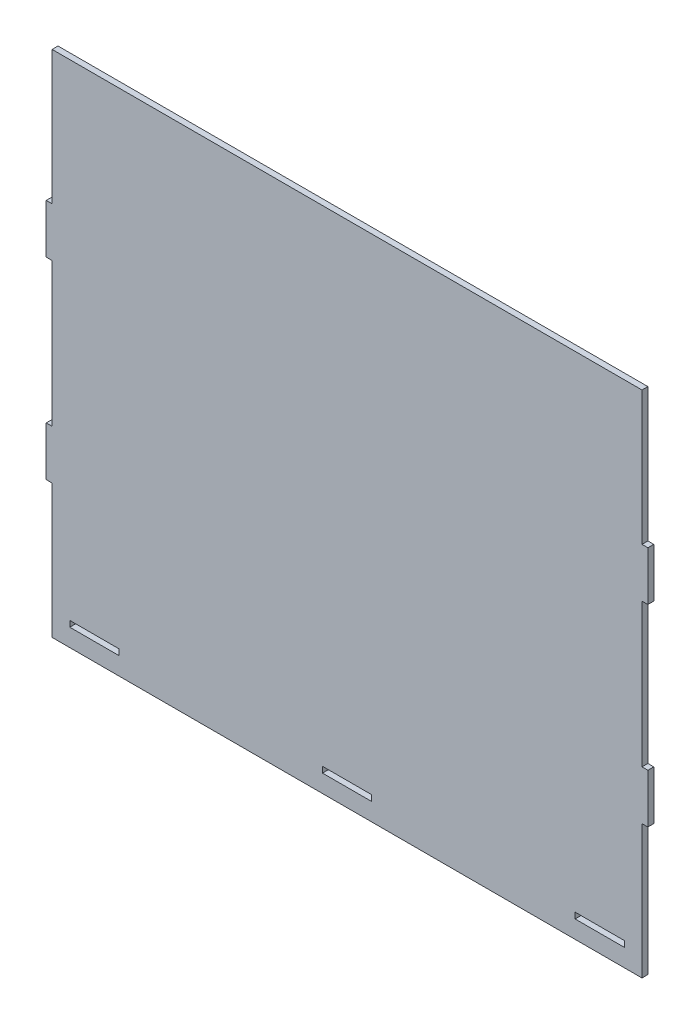
from build123d import *

# Parameters (mm, degrees)
SKETCH1_W           = 50
SKETCH1_H           = 6
BOSS_EXTRUDE1_DEPTH = 6


with BuildPart() as part:
    # Sketch1 → Boss-Extrude1 (new body)
    with BuildSketch(Plane.XY):
        Polygon((-300, 259), (300, 259), (300, 123), (306, 123), (306, 73), (300, 73), (300, -73), (306, -73), (306, -123), (300, -123), (300, -259), (-300, -259), (-300, -123), (-306, -123), (-306, -73), (-300, -73), (-300, 73), (-306, 73), (-306, 123), (-300, 123), align=None)
        with Locations((257, -238)):
            Rectangle(SKETCH1_W, SKETCH1_H, mode=Mode.SUBTRACT)
        with Locations((-257, -238)):
            Rectangle(SKETCH1_W, SKETCH1_H, mode=Mode.SUBTRACT)
        with Locations((0, -238)):
            Rectangle(SKETCH1_W, SKETCH1_H, mode=Mode.SUBTRACT)
    extrude(amount=BOSS_EXTRUDE1_DEPTH)


solid = part.part
